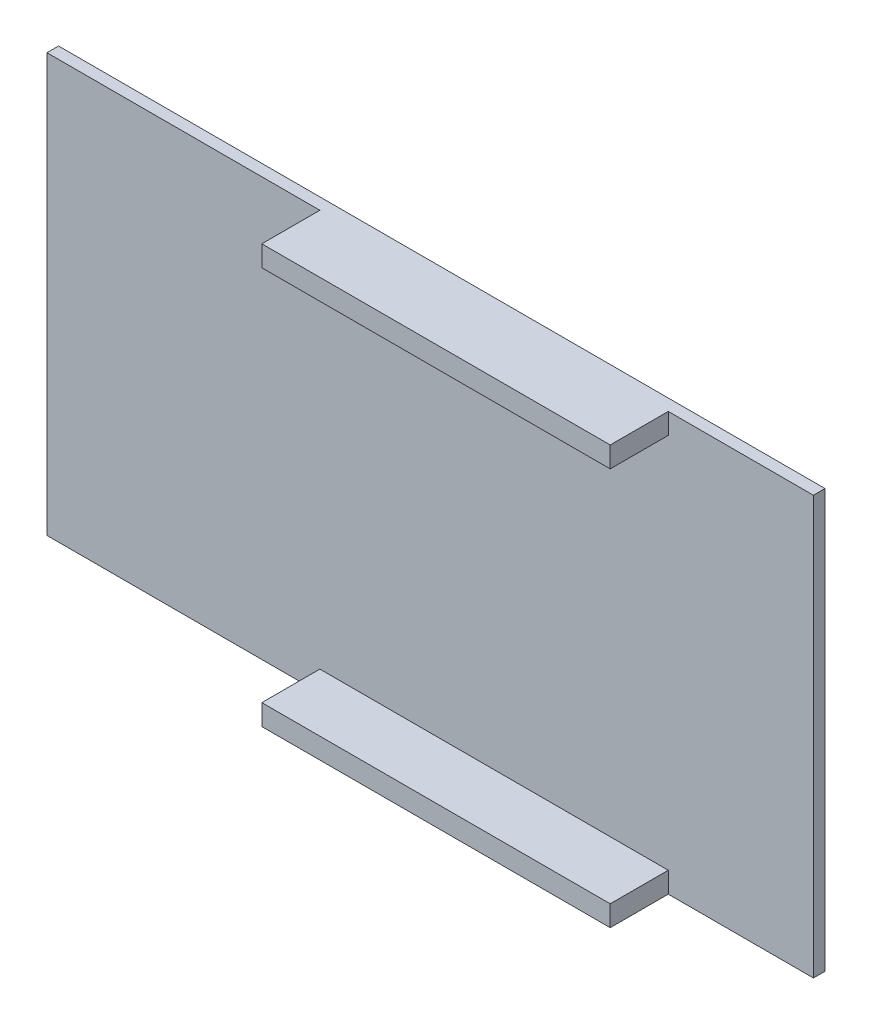
from build123d import *

# Parameters (mm, degrees)
SKETCH1_W           = 132
SKETCH1_H           = 72
BOSS_EXTRUDE1_DEPTH = 2
SKETCH2_W           = 60
SKETCH2_H           = 3.570225369
BOSS_EXTRUDE2_DEPTH = 10


with BuildPart() as part:
    # Sketch1 → Boss-Extrude1 (new body)
    with BuildSketch(Plane.XY):
        Rectangle(SKETCH1_W, SKETCH1_H)
    extrude(amount=BOSS_EXTRUDE1_DEPTH)

    # Sketch2 → Boss-Extrude2 (add)
    with BuildSketch(Plane.XY.offset(2)):
        with Locations((11, 34.214887316)):
            Rectangle(SKETCH2_W, SKETCH2_H)
    boss_extrude2 = extrude(amount=BOSS_EXTRUDE2_DEPTH)

    # Mirror1: Boss-Extrude2 across plane
    add(boss_extrude2.mirror(Plane.ZX))


solid = part.part
